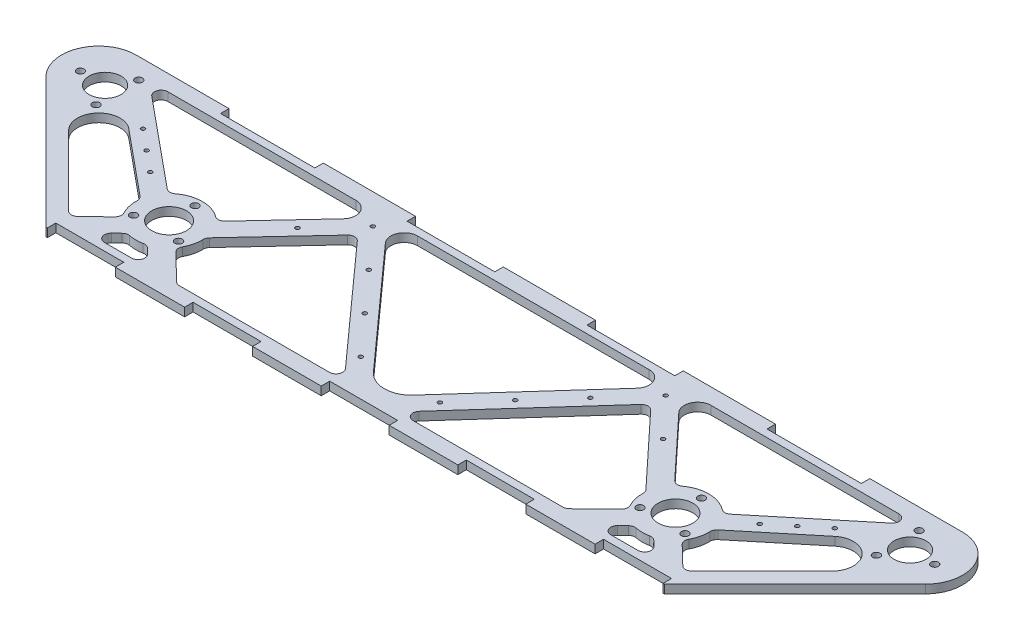
from build123d import *

# Parameters (mm, degrees)
BOSS_EXTRUDE1_DEPTH = 6.35
SKETCH2_R           = 12
SKETCH2_R_2         = 13
SKETCH2_R_3         = 2.75
CUT_EXTRUDE1_DEPTH  = 10
CUT_EXTRUDE4_DEPTH  = 10
SKETCH5_W           = 51
SKETCH5_H           = 6.36
CUT_EXTRUDE5_DEPTH  = 10
SKETCH6_W           = 70.8
SKETCH6_H           = 6.36
SKETCH6_W_2         = 65.79
SKETCH6_W_3         = 65.887878118
CUT_EXTRUDE6_DEPTH  = 10
SKETCH8_R           = 1.5
CUT_EXTRUDE7_DEPTH  = 6.35


with BuildPart() as part:
    # Sketch1 → Boss-Extrude1 (new body)
    with BuildSketch(Plane(origin=(0, 0, 0), x_dir=(1, 0, 0), z_dir=(0, 1, 0))):
        with BuildLine():
            Line((-232.01, 0), (232.01, 0))
            Line((232.01, 0), (329.893939059, 97.883939059))
            ThreePointArc((329.893939059, 97.883939059), (335.965743824, 128.408962941), (310.087878118, 145.7))
            Line((310.087878118, 145.7), (-310.087878118, 145.7))
            ThreePointArc((-310.087878118, 145.7), (-335.965743824, 128.408962941), (-329.893939059, 97.883939059))
            Line((-329.893939059, 97.883939059), (-232.01, 0))
        make_face()
    extrude(amount=BOSS_EXTRUDE1_DEPTH)

    # Sketch2 → Cut-Extrude1 (cut)
    with BuildSketch(Plane(origin=(0, 6.35, 0), x_dir=(1, 0, 0), z_dir=(0, 1, 0))):
        with Locations(Location((-302.0235, 114.35, 0), (0, 0, 270))):
            Circle(SKETCH2_R)
        with Locations(Location((-190, 50.35, 0), (0, 0, 270))):
            Circle(SKETCH2_R_2)
        with Locations(Location((-320.5235, 114.35, 0), (0, 0, 270))):
            Circle(SKETCH2_R_3)
        with Locations(Location((-292.7735, 130.37146997, 0), (0, 0, 270))):
            Circle(SKETCH2_R_3)
        with Locations(Location((-292.7735, 98.32853003, 0), (0, 0, 270))):
            Circle(SKETCH2_R_3)
        with Locations(Location((-190, 69.85, 0), (0, 0, 270))):
            Circle(SKETCH2_R_3)
        with Locations(Location((-173.112504626, 40.6, 0), (0, 0, 270))):
            Circle(SKETCH2_R_3)
        with Locations(Location((-206.887495374, 40.6, 0), (0, 0, 270))):
            Circle(SKETCH2_R_3)
        with Locations(Location((206.887495374, 40.6, 0), (0, 0, 90))):
            Circle(SKETCH2_R_3)
        with Locations(Location((173.112504626, 40.6, 0), (0, 0, 90))):
            Circle(SKETCH2_R_3)
        with Locations(Location((190, 69.85, 0), (0, 0, 90))):
            Circle(SKETCH2_R_3)
        with Locations(Location((292.7735, 98.32853003, 0), (0, 0, 90))):
            Circle(SKETCH2_R_3)
        with Locations(Location((292.7735, 130.37146997, 0), (0, 0, 90))):
            Circle(SKETCH2_R_3)
        with Locations(Location((320.5235, 114.35, 0), (0, 0, 90))):
            Circle(SKETCH2_R_3)
        with Locations(Location((190, 50.35, 0), (0, 0, 90))):
            Circle(SKETCH2_R_2)
        with Locations(Location((302.0235, 114.35, 0), (0, 0, 90))):
            Circle(SKETCH2_R)
    extrude(amount=-CUT_EXTRUDE1_DEPTH, mode=Mode.SUBTRACT)

    # Sketch3 → Cut-Extrude4 (cut)
    with BuildSketch(Plane(origin=(0, 6.35, 0), x_dir=(1, 0, 0), z_dir=(0, 1, 0))):
        with BuildLine():
            Line((-203.609801037, 20.59475985), (-199.510280391, 24.558045216))
            ThreePointArc((-199.510280391, 24.558045216), (-197.431061057, 25.764427124), (-195.029151341, 25.861071138))
            ThreePointArc((-195.029151341, 25.861071138), (-190, 25.35), (-184.970848659, 25.861071138))
            ThreePointArc((-184.970848659, 25.861071138), (-182.568938943, 25.764427124), (-180.489719609, 24.558045216))
            Line((-180.489719609, 24.558045216), (-176.390198963, 20.59475985))
            ThreePointArc((-176.390198963, 20.59475985), (-175.230101362, 15.125673354), (-179.865497744, 12))
            Line((-179.865497744, 12), (-200.134502256, 12))
            ThreePointArc((-200.134502256, 12), (-204.769898638, 15.125673354), (-203.609801037, 20.59475985))
        make_face()
        with BuildLine():
            Line((-216.797403535, 55.371430206), (-264.933334447, 95.044364046))
            ThreePointArc((-264.933334447, 95.044364046), (-286.953449794, 93.454792772), (-286.423184833, 71.383747582))
            Line((-286.423184833, 71.383747582), (-233.976968513, 18.937531261))
            ThreePointArc((-233.976968513, 18.937531261), (-230.483671979, 17.47324357), (-226.966135825, 18.878305318))
            Line((-226.966135825, 18.878305318), (-212.905914401, 32.47127743))
            ThreePointArc((-212.905914401, 32.47127743), (-211.439637745, 35.303913805), (-211.984344319, 38.446697733))
            ThreePointArc((-211.984344319, 38.446697733), (-214.348839226, 44.681311584), (-214.981206562, 51.319184556))
            ThreePointArc((-214.981206562, 51.319184556), (-215.414763854, 53.557994458), (-216.797403535, 55.371430206))
        make_face()
        with BuildLine():
            Line((-211.377331664, 70.342350872), (-277.502304442, 124.841591261))
            ThreePointArc((-277.502304442, 124.841591261), (-279.0282161, 130.389372118), (-274.322260103, 133.7))
            Line((-274.322260103, 133.7), (-133.275756536, 133.7))
            ThreePointArc((-133.275756536, 133.7), (-124.104559069, 127.68611804), (-125.964261402, 116.877827405))
            Line((-125.964261402, 116.877827405), (-168.6307126, 71.151111177))
            ThreePointArc((-168.6307126, 71.151111177), (-171.816187655, 69.584362226), (-175.238716805, 70.526831229))
            ThreePointArc((-175.238716805, 70.526831229), (-190.251609046, 75.348733826), (-205.164406104, 70.225633009))
            ThreePointArc((-205.164406104, 70.225633009), (-208.291202237, 69.20164169), (-211.377331664, 70.342350872))
        make_face()
        with BuildLine():
            Line((-94.343169344, 117.017095293), (-14.878008559, 28.561296949))
            ThreePointArc((-14.878008559, 28.561296949), (0, 21.927106364), (14.878008559, 28.561296949))
            Line((14.878008559, 28.561296949), (94.343169344, 117.017095293))
            ThreePointArc((94.343169344, 117.017095293), (96.037320244, 127.772527036), (86.904165065, 133.7))
            Line((86.904165065, 133.7), (-86.904165065, 133.7))
            ThreePointArc((-86.904165065, 133.7), (-96.037320244, 127.772527036), (-94.343169344, 117.017095293))
        make_face()
        with BuildLine():
            Line((-167.094085599, 32.47127743), (-147.372666059, 13.40524015))
            ThreePointArc((-147.372666059, 13.40524015), (-145.771693923, 12.364603617), (-143.897367277, 12))
            Line((-143.897367277, 12), (-31.377119137, 12))
            ThreePointArc((-31.377119137, 12), (-26.810541547, 14.963736482), (-27.657616997, 20.341452354))
            Line((-27.657616997, 20.341452354), (-106.350402898, 107.937489812))
            ThreePointArc((-106.350402898, 107.937489812), (-110.022699287, 109.595814615), (-113.725652605, 108.007123756))
            Line((-113.725652605, 108.007123756), (-163.664516336, 54.486378849))
            ThreePointArc((-163.664516336, 54.486378849), (-164.682404097, 52.852124796), (-165.007307308, 50.95441046))
            ThreePointArc((-165.007307308, 50.95441046), (-165.693185709, 44.503738032), (-168.015655681, 38.446697733))
            ThreePointArc((-168.015655681, 38.446697733), (-168.560362255, 35.303913805), (-167.094085599, 32.47127743))
        make_face()
        with BuildLine():
            Line((143.897367277, 12), (31.377119137, 12))
            ThreePointArc((31.377119137, 12), (26.810541547, 14.963736482), (27.657616997, 20.341452354))
            Line((27.657616997, 20.341452354), (106.350402898, 107.937489812))
            ThreePointArc((106.350402898, 107.937489812), (110.022699287, 109.595814615), (113.725652605, 108.007123756))
            Line((113.725652605, 108.007123756), (163.664516336, 54.486378849))
            ThreePointArc((163.664516336, 54.486378849), (164.682404097, 52.852124796), (165.007307308, 50.95441046))
            ThreePointArc((165.007307308, 50.95441046), (165.693185709, 44.503738032), (168.015655681, 38.446697733))
            ThreePointArc((168.015655681, 38.446697733), (168.560362255, 35.303913805), (167.094085599, 32.47127743))
            Line((167.094085599, 32.47127743), (147.372666059, 13.40524015))
            ThreePointArc((147.372666059, 13.40524015), (145.771693923, 12.364603617), (143.897367277, 12))
        make_face()
        with BuildLine():
            Line((200.134502256, 12), (179.865497744, 12))
            ThreePointArc((179.865497744, 12), (175.230101362, 15.125673354), (176.390198963, 20.59475985))
            Line((176.390198963, 20.59475985), (180.489719609, 24.558045216))
            ThreePointArc((180.489719609, 24.558045216), (182.568938943, 25.764427124), (184.970848659, 25.861071138))
            ThreePointArc((184.970848659, 25.861071138), (190, 25.35), (195.029151341, 25.861071138))
            ThreePointArc((195.029151341, 25.861071138), (197.431061057, 25.764427124), (199.510280391, 24.558045216))
            Line((199.510280391, 24.558045216), (203.609801037, 20.59475985))
            ThreePointArc((203.609801037, 20.59475985), (204.769898638, 15.125673354), (200.134502256, 12))
        make_face()
        with BuildLine():
            Line((286.423184833, 71.383747582), (233.976968513, 18.937531261))
            ThreePointArc((233.976968513, 18.937531261), (230.483671979, 17.47324357), (226.966135825, 18.878305318))
            Line((226.966135825, 18.878305318), (212.905914401, 32.47127743))
            ThreePointArc((212.905914401, 32.47127743), (211.439637745, 35.303913805), (211.984344319, 38.446697733))
            ThreePointArc((211.984344319, 38.446697733), (214.348839226, 44.681311584), (214.981206562, 51.319184556))
            ThreePointArc((214.981206562, 51.319184556), (215.414763854, 53.557994458), (216.797403535, 55.371430206))
            Line((216.797403535, 55.371430206), (264.933334447, 95.044364046))
            ThreePointArc((264.933334447, 95.044364046), (286.953449794, 93.454792772), (286.423184833, 71.383747582))
        make_face()
        with BuildLine():
            Line((168.6307126, 71.151111177), (125.964261402, 116.877827405))
            ThreePointArc((125.964261402, 116.877827405), (124.104559069, 127.68611804), (133.275756536, 133.7))
            Line((133.275756536, 133.7), (274.322260103, 133.7))
            ThreePointArc((274.322260103, 133.7), (279.0282161, 130.389372118), (277.502304442, 124.841591261))
            Line((277.502304442, 124.841591261), (211.377331664, 70.342350872))
            ThreePointArc((211.377331664, 70.342350872), (208.291202237, 69.20164169), (205.164406104, 70.225633009))
            ThreePointArc((205.164406104, 70.225633009), (190.251609046, 75.348733826), (175.238716805, 70.526831229))
            ThreePointArc((175.238716805, 70.526831229), (171.816187655, 69.584362226), (168.6307126, 71.151111177))
        make_face()
    extrude(amount=-CUT_EXTRUDE4_DEPTH, mode=Mode.SUBTRACT)

    # Sketch5 → Cut-Extrude5 (cut)
    with BuildSketch(Plane(origin=(0, 6.35, 0), x_dir=(1, 0, 0), z_dir=(0, 1, 0))):
        with Locations((-205.51, 3.18)):
            Rectangle(SKETCH5_W, SKETCH5_H)
        with Locations((0, 3.18)):
            Rectangle(SKETCH5_W, SKETCH5_H)
        with Locations((-102.51, 3.18)):
            Rectangle(SKETCH5_W, SKETCH5_H)
        with Locations((102.51, 3.18)):
            Rectangle(SKETCH5_W, SKETCH5_H)
        with Locations((205.51, 3.18)):
            Rectangle(SKETCH5_W, SKETCH5_H)
    extrude(amount=-CUT_EXTRUDE5_DEPTH, mode=Mode.SUBTRACT)

    # Sketch6 → Cut-Extrude6 (cut)
    with BuildSketch(Plane(origin=(0, 6.35, 0), x_dir=(1, 0, 0), z_dir=(0, 1, 0))):
        with Locations((-204.99, 142.52)):
            Rectangle(SKETCH6_W, SKETCH6_H)
        with Locations((-67.495, 142.52)):
            Rectangle(SKETCH6_W_2, SKETCH6_H)
        with Locations((67.543939059, 142.52)):
            Rectangle(SKETCH6_W_3, SKETCH6_H)
        with Locations((205.087878118, 142.52)):
            Rectangle(SKETCH6_W, SKETCH6_H)
    extrude(amount=-CUT_EXTRUDE6_DEPTH, mode=Mode.SUBTRACT)

    # Sketch8 → Cut-Extrude7 (cut)
    with BuildSketch(Plane(origin=(0, 6.35, 0), x_dir=(1, 0, 0), z_dir=(0, 1, 0))):
        with Locations(Location((259.552919224, 100.328936625, 0), (0, 0, 270))):
            Circle(SKETCH8_R)
        with Locations(Location((244.119284267, 87.608759267, 0), (0, 0, 270))):
            Circle(SKETCH8_R)
        with Locations(Location((228.685649311, 74.888581908, 0), (0, 0, 270))):
            Circle(SKETCH8_R)
        with Locations(Location((137.183832822, 93.859963278, 0), (0, 0, 270))):
            Circle(SKETCH8_R)
        with Locations(Location((109.895142443, 123.105943813, 0), (0, 0, 270))):
            Circle(SKETCH8_R)
        with Locations(Location((83.163523613, 93.349926694, 0), (0, 0, 270))):
            Circle(SKETCH8_R)
        with Locations(Location((56.431904783, 63.593909576, 0), (0, 0, 270))):
            Circle(SKETCH8_R)
        with Locations(Location((29.700285953, 33.837892458, 0), (0, 0, 270))):
            Circle(SKETCH8_R)
        with Locations(Location((-29.700285953, 33.837892458, 0), (0, 0, 270))):
            Circle(SKETCH8_R)
        with Locations(Location((-56.431904783, 63.593909576, 0), (0, 0, 270))):
            Circle(SKETCH8_R)
        with Locations(Location((-83.163523613, 93.349926694, 0), (0, 0, 270))):
            Circle(SKETCH8_R)
        with Locations(Location((-109.895142443, 123.105943813, 0), (0, 0, 270))):
            Circle(SKETCH8_R)
        with Locations(Location((-137.183832822, 93.859963278, 0), (0, 0, 270))):
            Circle(SKETCH8_R)
        with Locations(Location((-228.685649311, 74.888581908, 0), (0, 0, 270))):
            Circle(SKETCH8_R)
        with Locations(Location((-244.119284267, 87.608759267, 0), (0, 0, 270))):
            Circle(SKETCH8_R)
        with Locations(Location((-259.552919224, 100.328936625, 0), (0, 0, 270))):
            Circle(SKETCH8_R)
    extrude(amount=-CUT_EXTRUDE7_DEPTH, mode=Mode.SUBTRACT)


solid = part.part
